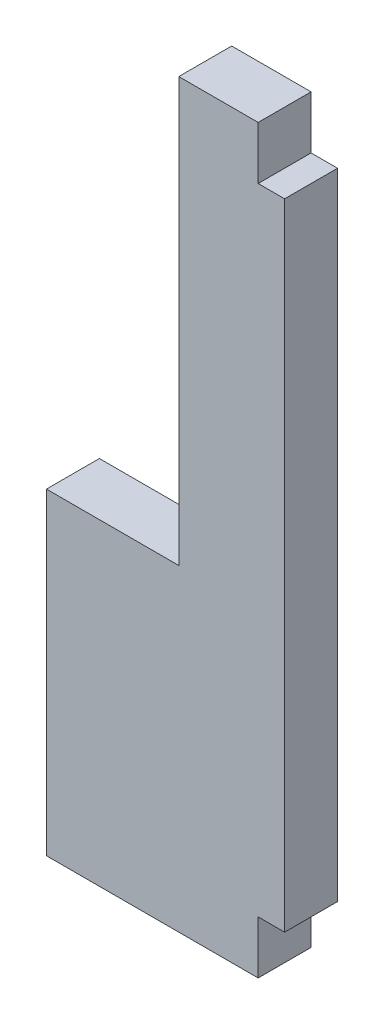
from build123d import *

# Parameters (mm, degrees)
BOSS_EXTRUDE1_DEPTH = 10


with BuildPart() as part:
    # Sketch2 → Boss-Extrude1 (new body)
    with BuildSketch(Plane.XY):
        Polygon((0, 120), (-5, 120), (-5, 130), (-20, 130), (-20, 50), (-45, 50), (-45, -10), (-5, -10), (-5, 0), (0, 0), align=None)
    extrude(amount=BOSS_EXTRUDE1_DEPTH)


solid = part.part
